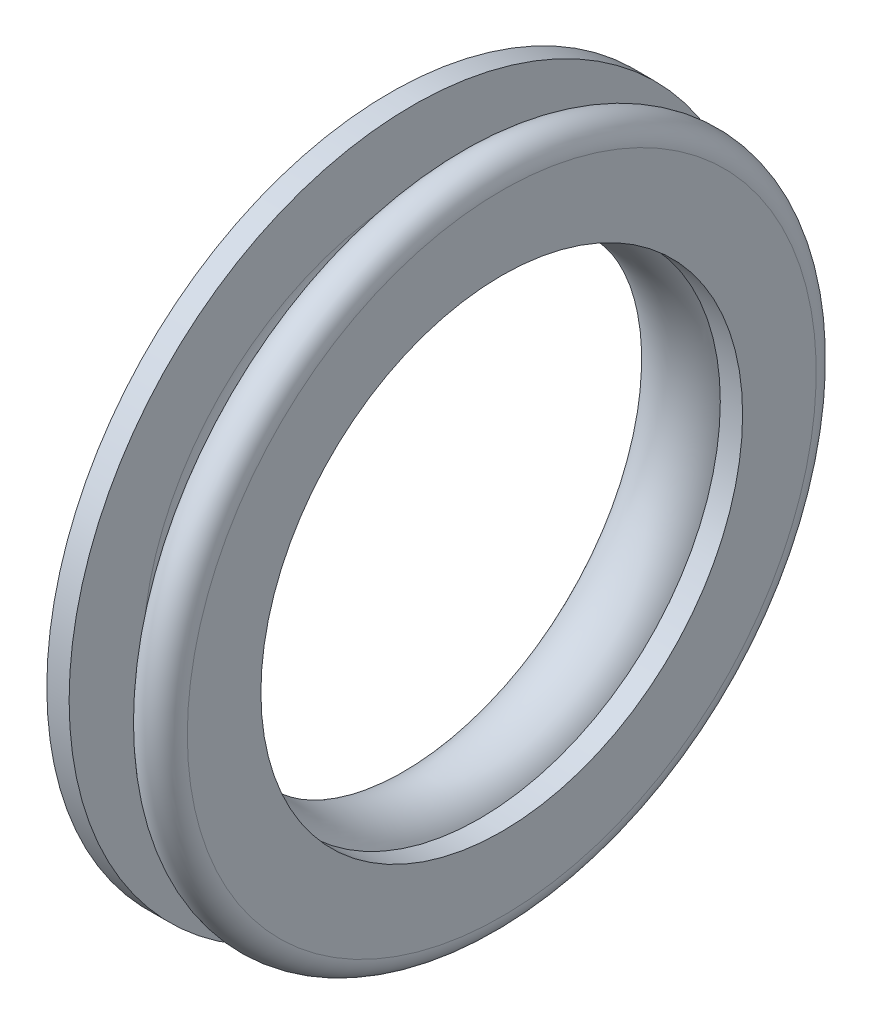
from build123d import *


with BuildPart() as part:
    # Sketch2 → Revolve1 (revolve)
    with BuildSketch(Plane.XY, mode=Mode.PRIVATE) as revolve1_sk:
        with BuildLine():
            Line((0, 7.7), (0, 6.05))
            ThreePointArc((0, 6.05), (1, 5.05), (2, 6.05))
            Line((2, 6.05), (2, 5.4))
            Line((2, 5.4), (2.5, 5.4))
            Line((2.5, 5.4), (2.5, 7.05))
            ThreePointArc((2.5, 7.05), (2, 7.55), (1.5, 7.05))
            Line((1.5, 7.05), (1.5, 6.05))
            ThreePointArc((1.5, 6.05), (1, 5.55), (0.5, 6.05))
            Line((0.5, 6.05), (0.5, 7.7))
            Line((0.5, 7.7), (0, 7.7))
        make_face()
    revolve(revolve1_sk.sketch.rotate(Axis((0, 0, 0), (1, 0, 0)), 90), axis=Axis((0, 0, 0), (1, 0, 0)))


solid = part.part
